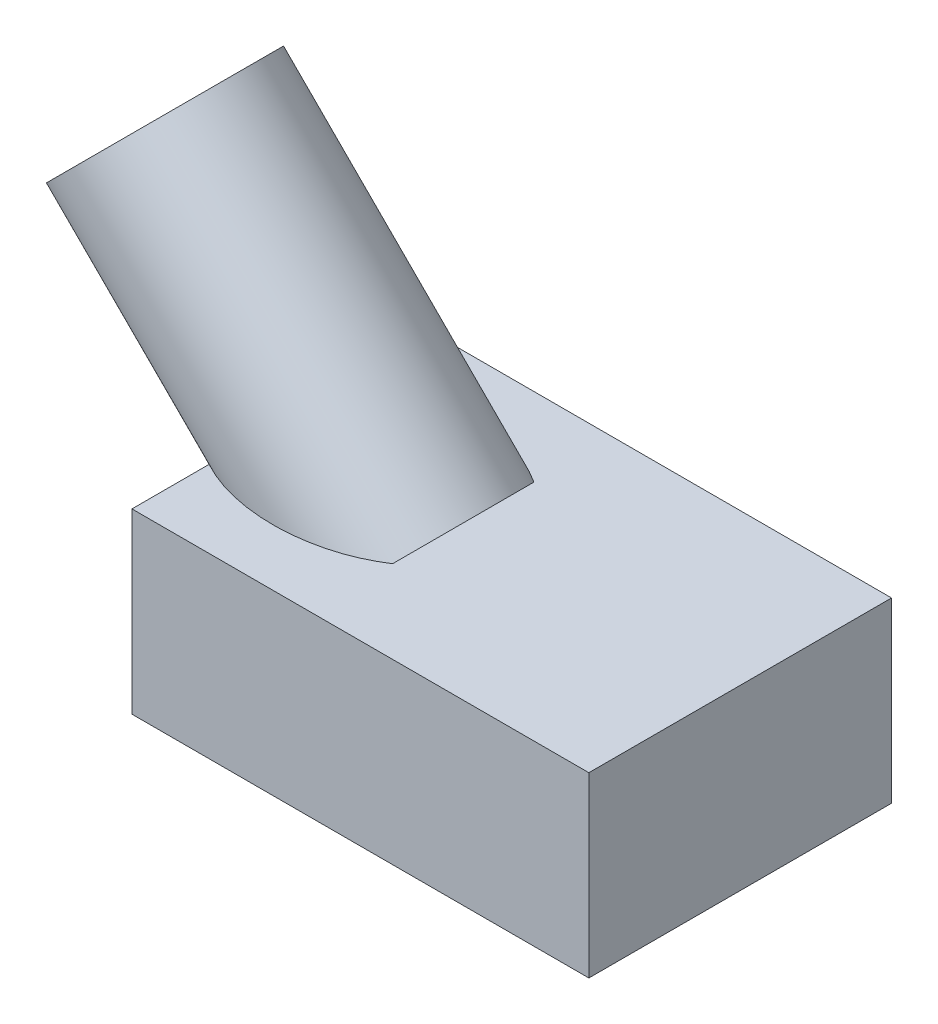
from build123d import *

# Parameters (mm, degrees)
SKETCH2_W           = 128.497517737
SKETCH2_H           = 85.119374807
BOSS_EXTRUDE1_DEPTH = 50
SKETCH3_R           = 27.225634724
BOSS_EXTRUDE2_DEPTH = 100


with BuildPart() as part:
    # Sketch2 → Boss-Extrude1 (new body)
    with BuildSketch(Plane(origin=(0, 0, 0), x_dir=(1, 0, 0), z_dir=(0, 1, 0))):
        with Locations((-9.412238561, -0.613841645)):
            Rectangle(SKETCH2_W, SKETCH2_H)
    extrude(amount=BOSS_EXTRUDE1_DEPTH)

    # Sketch3 → Boss-Extrude2 (add)
    with BuildSketch(Plane(origin=(-36.830498714, 36.830498714, 0), x_dir=(0, 0, 1), z_dir=(-0.7071067811865488, 0.7071067811865464, 0))):
        with Locations(Location((0, 0, 0), (0, 0, 136.836774517))):
            Circle(SKETCH3_R)
    extrude(amount=BOSS_EXTRUDE2_DEPTH)


solid = part.part
